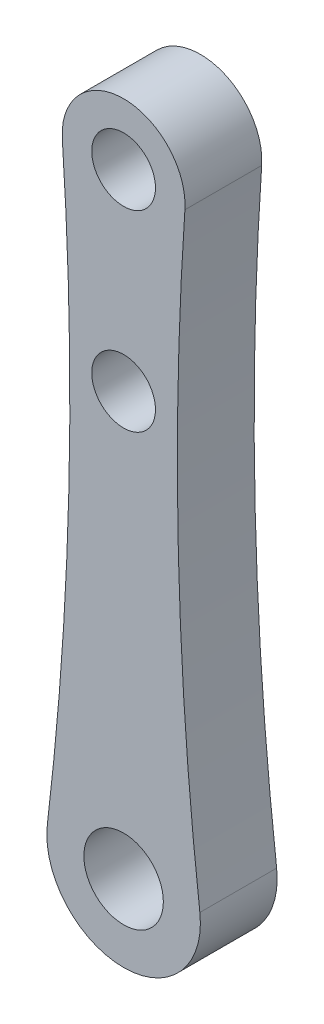
from build123d import *

# Parameters (mm, degrees)
SKETCH1_R   = 5.175
SKETCH1_R_2 = 4.15
CORPO_DEPTH = 10


with BuildPart() as part:
    # Sketch1 → Corpo (new body)
    with BuildSketch(Plane.XY):
        with BuildLine():
            ThreePointArc((7.981333919, 39.4538234), (0, 48), (-7.981333919, 39.4538234))
            ThreePointArc((-7.981333919, 39.4538234), (-7.130314136, 0.270652057), (-9.930327324, -38.821611594))
            ThreePointArc((-9.930327324, -38.821611594), (0, -50), (9.930327324, -38.821611594))
            ThreePointArc((9.930327324, -38.821611594), (7.130314136, 0.270652057), (7.981333919, 39.4538234))
        make_face()
        with Locations((0, -40)):
            Circle(SKETCH1_R, mode=Mode.SUBTRACT)
        with Locations((0, 40)):
            Circle(SKETCH1_R_2, mode=Mode.SUBTRACT)
        with Locations((0, 15)):
            Circle(SKETCH1_R_2, mode=Mode.SUBTRACT)
    extrude(amount=CORPO_DEPTH)


solid = part.part
